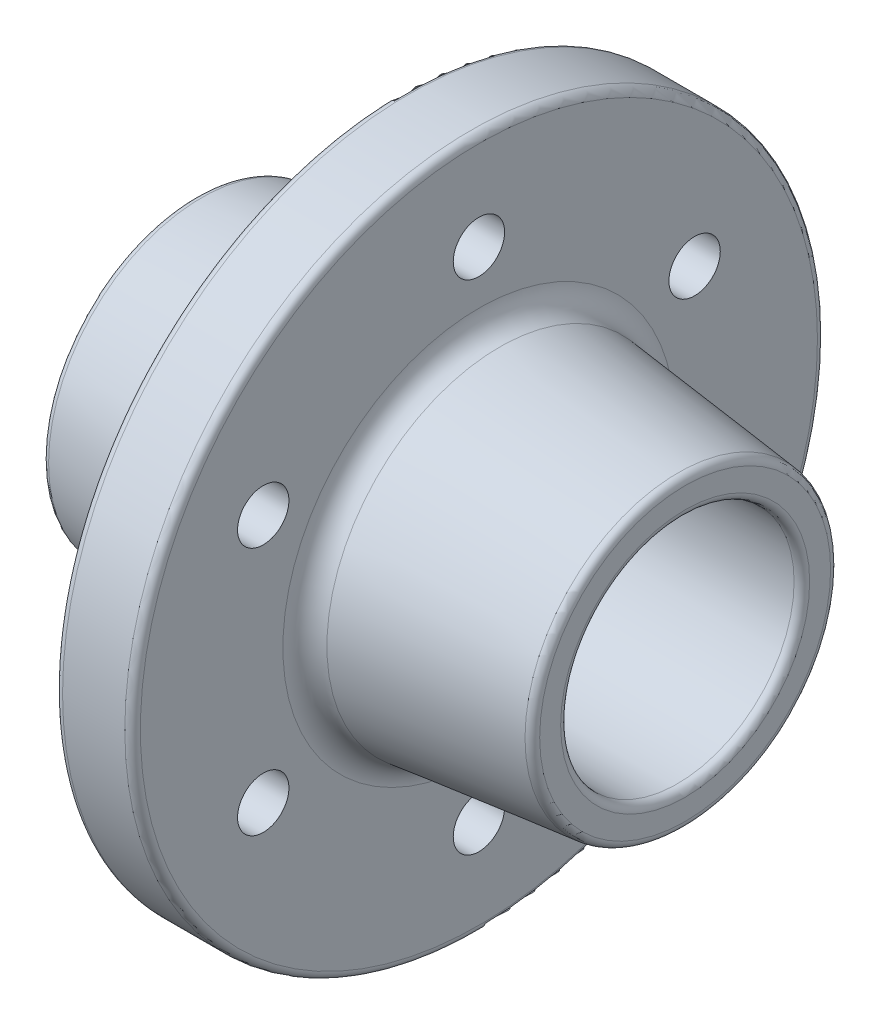
from build123d import *

# Parameters (mm, degrees)
SKETCH1_R            = 44.5
BOSS_EXTRUDE1_DEPTH  = 10
SKETCH3_R            = 22.5
BOSS_EXTRUDE2_DEPTH  = 26.5
BOSS_EXTRUDE2_TAPER  = 6.27
SKETCH4_R            = 22.5
BOSS_EXTRUDE3_DEPTH  = 26.5
BOSS_EXTRUDE3_TAPER  = 6.27
FILLET1_R            = 3
FILLET2_R            = 3
SKETCH5_R            = 15
CUT_EXTRUDE1_DEPTH   = 90.047740076
FILLET3_R            = 1
FILLET4_R            = 1
FILLET5_R            = 1
M6_CLEARANCE_HOLE2_D = 6.6
CIRPATTERN2_COUNT    = 6


with BuildPart() as part:
    # Sketch1 → Boss-Extrude1 (new body)
    with BuildSketch(Plane(origin=(0, 0, 0), x_dir=(0, 0, -1), z_dir=(1, 0, 0))):
        Circle(SKETCH1_R)
    extrude(amount=BOSS_EXTRUDE1_DEPTH)

    # Sketch3 → Boss-Extrude2 (add)
    with BuildSketch(Plane.ZY):
        Circle(SKETCH3_R)
    extrude(amount=BOSS_EXTRUDE2_DEPTH, taper=BOSS_EXTRUDE2_TAPER)

    # Sketch4 → Boss-Extrude3 (add)
    with BuildSketch(Plane(origin=(10, 0, 0), x_dir=(0, 0, -1), z_dir=(1, 0, 0))):
        Circle(SKETCH4_R)
    extrude(amount=BOSS_EXTRUDE3_DEPTH, taper=BOSS_EXTRUDE3_TAPER)

    # Fillet1
    fillet1_edges = [part.edges().sort_by_distance(p)[0] for p in [
        (10, 0, 22.5),
    ]]
    fillet(fillet1_edges, radius=FILLET1_R)

    # Fillet2
    fillet2_edges = [part.edges().sort_by_distance(p)[0] for p in [
        (0, 0, -22.5),
    ]]
    fillet(fillet2_edges, radius=FILLET2_R)

    # Sketch5 → Cut-Extrude1 (cut, through all)
    with BuildSketch(Plane(origin=(36.5, 0, 0), x_dir=(0, 0, -1), z_dir=(1, 0, 0))):
        Circle(SKETCH5_R)
    extrude(amount=-CUT_EXTRUDE1_DEPTH, mode=Mode.SUBTRACT)

    # Fillet3
    fillet3_edges = [part.edges().sort_by_distance(p)[0] for p in [
        (36.5, 0, 19.588416438),
        (36.5, 0, 15),
    ]]
    fillet(fillet3_edges, radius=FILLET3_R)

    # Fillet4
    fillet4_edges = [part.edges().sort_by_distance(p)[0] for p in [
        (-26.5, 0, 15),
        (-26.5, 0, -19.588416438),
    ]]
    fillet(fillet4_edges, radius=FILLET4_R)

    # Fillet5
    fillet5_edges = [part.edges().sort_by_distance(p)[0] for p in [
        (0, 0, 44.5),
        (10, 0, 44.5),
    ]]
    fillet(fillet5_edges, radius=FILLET5_R)

    # M6 Clearance Hole2 (through all)
    with Locations(Plane.ZY):
        with Locations((0, 32)):
            m6_clearance_hole2 = Hole(M6_CLEARANCE_HOLE2_D / 2)

    # CirPattern2: M6 Clearance Hole2 ×6 about axis
    cirpattern2_axis = Axis((0, 0, 0), (1, 0, 0))
    for i in range(1, CIRPATTERN2_COUNT):
        add(m6_clearance_hole2.rotate(cirpattern2_axis, i * 360 / CIRPATTERN2_COUNT), mode=Mode.SUBTRACT)


solid = part.part
